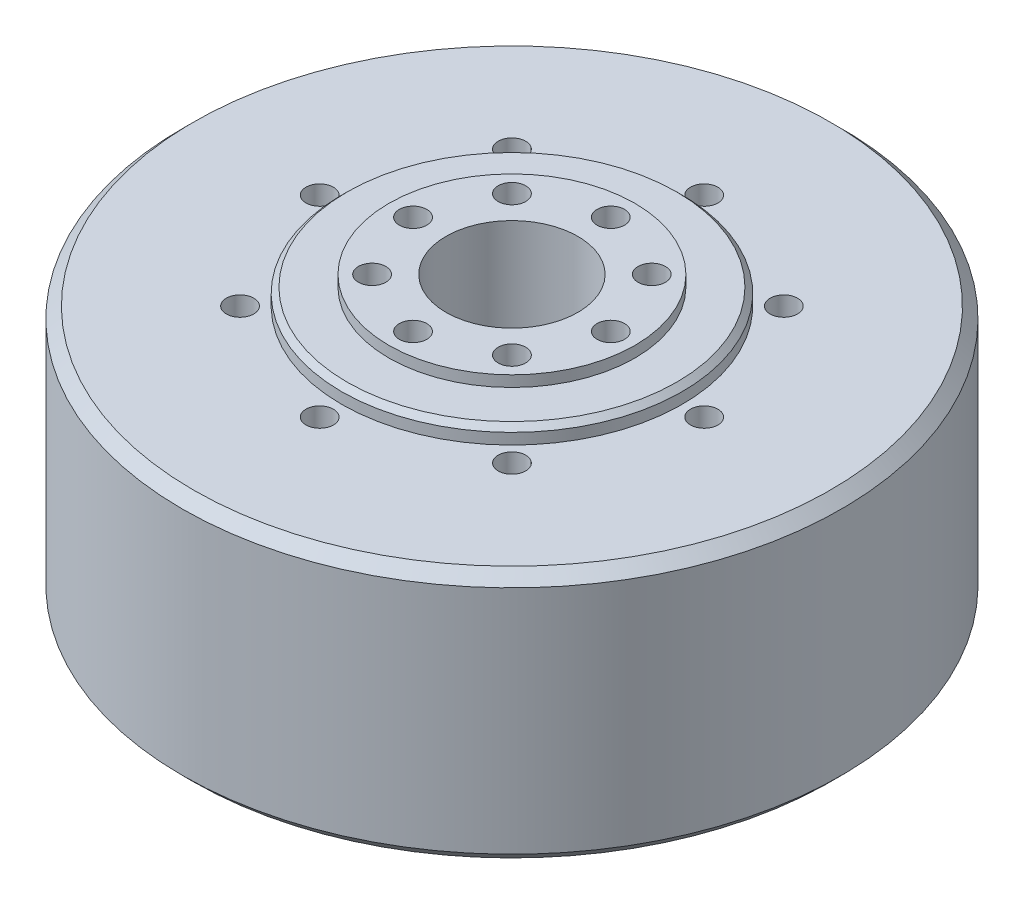
from build123d import *

# Parameters (mm, degrees)
SKETCH1_R               = 60
BOSS_EXTRUDE1_DEPTH     = 46
SKETCH2_R               = 32
BOSS_EXTRUDE2_DEPTH     = 12
SKETCH3_R               = 31
BOSS_EXTRUDE3_DEPTH     = 3
SKETCH4_R               = 22.4
BOSS_EXTRUDE4_DEPTH     = 2
SKETCH6_R               = 12
CUT_EXTRUDE1_DEPTH      = 50
SKETCH8_R               = 2.5
CUT_EXTRUDE2_DEPTH      = 12
CUT_EXTRUDE3_DEPTH      = 103.78132126
CUT_EXTRUDE3_DEPTH_BACK = 103.78132126
SKETCH9_R               = 2.5
CHAMFER1_SIZE           = 2
CHAMFER2_SIZE           = 1


with BuildPart() as part:
    # Sketch1 → Boss-Extrude1 (new body)
    with BuildSketch(Plane(origin=(0, 0, 0), x_dir=(1, 0, 0), z_dir=(0, 1, 0))):
        Circle(SKETCH1_R)
    extrude(amount=BOSS_EXTRUDE1_DEPTH)

    # Sketch2 → Boss-Extrude2 (add)
    with BuildSketch(Plane.XZ):
        Circle(SKETCH2_R)
    extrude(amount=BOSS_EXTRUDE2_DEPTH)

    # Sketch3 → Boss-Extrude3 (add)
    with BuildSketch(Plane(origin=(0, 46, 0), x_dir=(1, 0, 0), z_dir=(0, 1, 0))):
        Circle(SKETCH3_R)
    extrude(amount=BOSS_EXTRUDE3_DEPTH)

    # Sketch4 → Boss-Extrude4 (add)
    with BuildSketch(Plane(origin=(0, 49, 0), x_dir=(1, 0, 0), z_dir=(0, 1, 0))):
        Circle(SKETCH4_R)
    extrude(amount=BOSS_EXTRUDE4_DEPTH)

    # Sketch6 → Cut-Extrude1 (cut)
    with BuildSketch(Plane(origin=(0, 51, 0), x_dir=(1, 0, 0), z_dir=(0, 1, 0))):
        Circle(SKETCH6_R)
    extrude(amount=-CUT_EXTRUDE1_DEPTH, mode=Mode.SUBTRACT)

    # Sketch8 → Cut-Extrude2 (cut)
    with BuildSketch(Plane(origin=(0, 51, 0), x_dir=(1, 0, 0), z_dir=(0, 1, 0))):
        with Locations((0, 18)):
            Circle(SKETCH8_R)
        with Locations((12.727922061, 12.727922061)):
            Circle(SKETCH8_R)
        with Locations((18, 0)):
            Circle(SKETCH8_R)
        with Locations((12.727922061, -12.727922061)):
            Circle(SKETCH8_R)
        with Locations((0, -18)):
            Circle(SKETCH8_R)
        with Locations((-12.727922061, -12.727922061)):
            Circle(SKETCH8_R)
        with Locations((-18, 0)):
            Circle(SKETCH8_R)
        with Locations((-12.727922061, 12.727922061)):
            Circle(SKETCH8_R)
    extrude(amount=-CUT_EXTRUDE2_DEPTH, mode=Mode.SUBTRACT)

    # Sketch9 → Cut-Extrude3 (cut, two sides: drawn at the far end of the back side and taken through both)
    with BuildSketch(Plane(origin=(0, 46, 0), x_dir=(1, 0, 0), z_dir=(0, 1, 0)).offset(-CUT_EXTRUDE3_DEPTH_BACK)):
        with Locations((0, 35)):
            Circle(SKETCH9_R)
        with Locations((24.748737342, 24.748737342)):
            Circle(SKETCH9_R)
        with Locations((35, 0)):
            Circle(SKETCH9_R)
        with Locations((24.748737342, -24.748737342)):
            Circle(SKETCH9_R)
        with Locations((0, -35)):
            Circle(SKETCH9_R)
        with Locations((-24.748737342, -24.748737342)):
            Circle(SKETCH9_R)
        with Locations((-35, 0)):
            Circle(SKETCH9_R)
        with Locations((-24.748737342, 24.748737342)):
            Circle(SKETCH9_R)
    extrude(amount=CUT_EXTRUDE3_DEPTH + CUT_EXTRUDE3_DEPTH_BACK, mode=Mode.SUBTRACT)

    # Chamfer1
    chamfer1_edges = [part.edges().sort_by_distance(p)[0] for p in [
        (-60, 0, 0),
        (-60, 46, 0),
    ]]
    chamfer(chamfer1_edges, length=CHAMFER1_SIZE)

    # Chamfer2
    chamfer2_edges = [part.edges().sort_by_distance(p)[0] for p in [
        (-31, 49, 0),
        (-32, -12, 0),
    ]]
    chamfer(chamfer2_edges, length=CHAMFER2_SIZE)


solid = part.part
